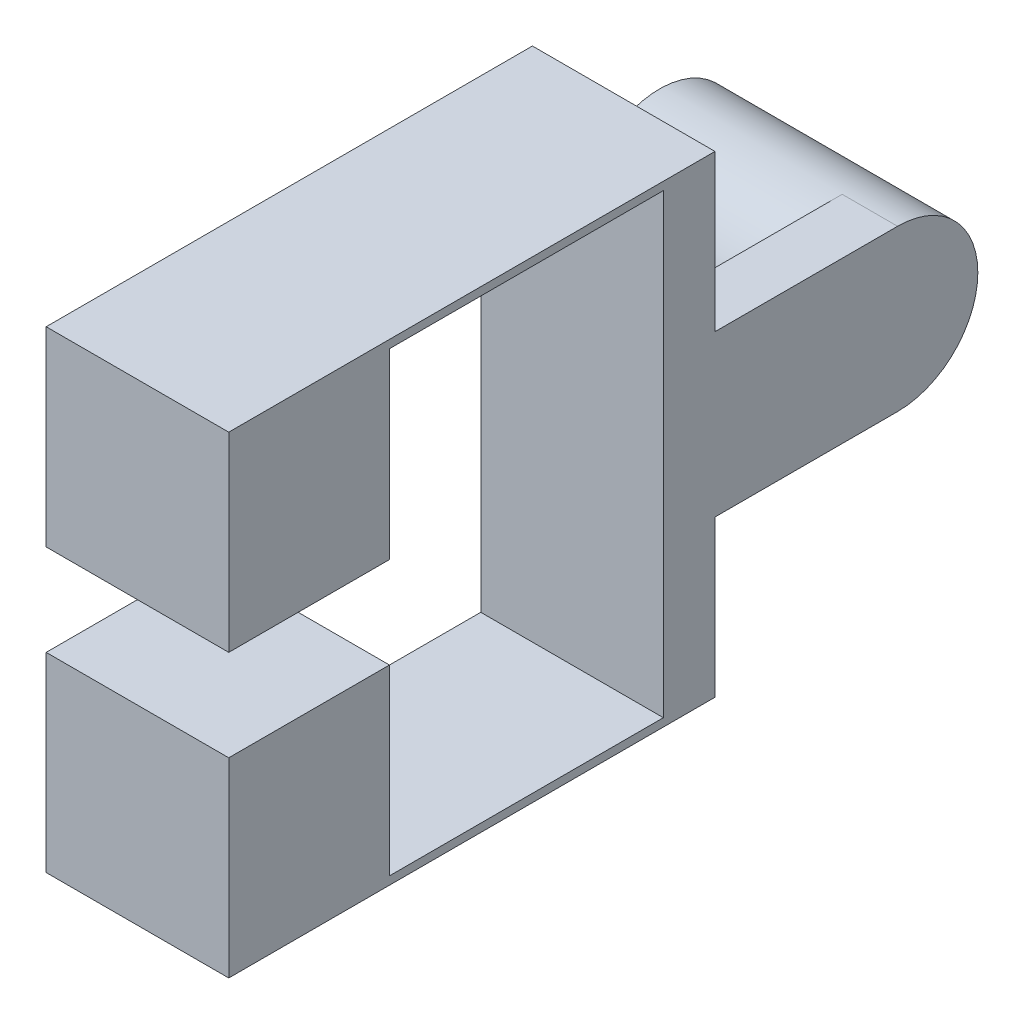
from build123d import *

# Parameters (mm, degrees)
FEATURE_B_DEPTH     = 7.706067936
FEATURE_START       = 25.4
SKETCH3_R           = 11.162804955
FEATURE_A_DEPTH     = 25.4
SKETCH5_W           = 65.757777778
SKETCH5_H           = 7.184204897
FEATURE_C_DEPTH     = 25.4
SKETCH6_W           = 25.4
SKETCH6_H           = 1.128888889
FEATURE_D_DEPTH     = 38.1
SKETCH8_W           = 25.4
SKETCH8_H           = 26.528888889
BOSS_EXTRUDE5_DEPTH = 22.354838115


with BuildPart() as part:
    # Sketch1 → Feature B (new body)
    with BuildSketch(Plane.YZ):
        with BuildLine():
            Line((0, 0), (0, 25.4))
            Line((0, 25.4), (22.32560991, 25.4))
            Line((22.32560991, 25.4), (22.32560991, 0))
            ThreePointArc((22.32560991, 0), (11.162804955, -11.162804955), (0, 0))
        make_face()
    extrude(amount=FEATURE_B_DEPTH)

    # Sketch3 → Feature A (add)
    with BuildSketch(Plane(origin=(0, 0, 0), x_dir=(0, -1, 0), z_dir=(-1, 0, 0)).offset(FEATURE_START)):
        with Locations(Location((-11.162804955, 0, 0), (0, 0, 90))):
            Circle(SKETCH3_R)
    extrude(amount=-FEATURE_A_DEPTH)

    # Sketch5 → Feature C (add)
    with BuildSketch(Plane.YZ.offset(7.706067936)):
        with Locations((11.162804955, 28.992102448)):
            Rectangle(SKETCH5_W, SKETCH5_H)
    extrude(amount=-FEATURE_C_DEPTH)

    # Sketch6 → Feature D (add)
    with BuildSketch(Plane.XY.offset(32.584204897)):
        with Locations((-4.993932064, -21.151639489)):
            Rectangle(SKETCH6_W, SKETCH6_H)
        with Locations((-4.993932064, 43.4772494)):
            Rectangle(SKETCH6_W, SKETCH6_H)
    extrude(amount=FEATURE_D_DEPTH)

    # Sketch8 → Boss-Extrude5 (add)
    with BuildSketch(Plane.XY.offset(70.684204897)):
        with Locations((-4.993932064, -8.451639489)):
            Rectangle(SKETCH8_W, SKETCH8_H)
        with Locations((-4.993932064, 30.7772494)):
            Rectangle(SKETCH8_W, SKETCH8_H)
    extrude(amount=BOSS_EXTRUDE5_DEPTH)


solid = part.part
